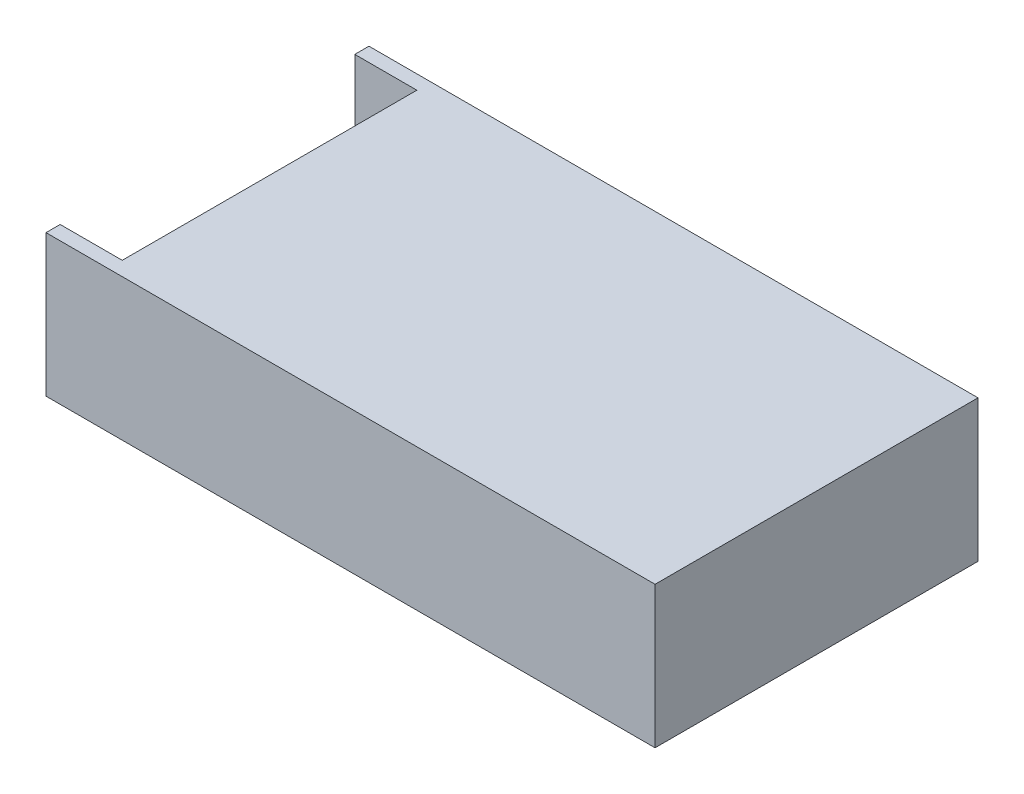
from build123d import *

# Parameters (mm, degrees)
ESBO_O1_W                = 215
ESBO_O1_H                = 114
RESSALTO_EXTRUS_O1_DEPTH = 50
CORTE_EXTRUS_O1_START    = -5
CORTE_EXTRUS_O1_DEPTH    = 104
ESBO_O4_R                = 2
CORTE_EXTRUS_O2_DEPTH    = 10


with BuildPart() as part:
    # Esboço1 → Ressalto-extrusão1 (new body)
    with BuildSketch(Plane(origin=(0, 0, 0), x_dir=(1, 0, 0), z_dir=(0, 1, 0))):
        Rectangle(ESBO_O1_W, ESBO_O1_H)
    extrude(amount=RESSALTO_EXTRUS_O1_DEPTH)

    # Esboço3 → Corte-extrusão1 (cut)
    with BuildSketch(Plane.XY.offset(57).offset(CORTE_EXTRUS_O1_START)):
        Polygon((-107.5, 50), (-85.58523496, 50), (-85.58523496, 16.13389081), (-102.483117777, 16.13389081), (-102.483117777, 6.426889092), (-107.5, 6.426889092), (-107.5, 17.457061978), align=None)
    extrude(amount=-CORTE_EXTRUS_O1_DEPTH, mode=Mode.SUBTRACT)

    # Esboço4 → Corte-extrusão2 (cut)
    with BuildSketch(Plane.XZ):
        with Locations(Location((96, 42, 0), (0, 0, 270))):
            Circle(ESBO_O4_R)
        with Locations(Location((-29.6, 42, 0), (0, 0, 270))):
            Circle(ESBO_O4_R)
        with Locations(Location((-29.6, -43, 0), (0, 0, 270))):
            Circle(ESBO_O4_R)
        with Locations(Location((96, -43, 0), (0, 0, 270))):
            Circle(ESBO_O4_R)
    extrude(amount=-CORTE_EXTRUS_O2_DEPTH, mode=Mode.SUBTRACT)


solid = part.part
